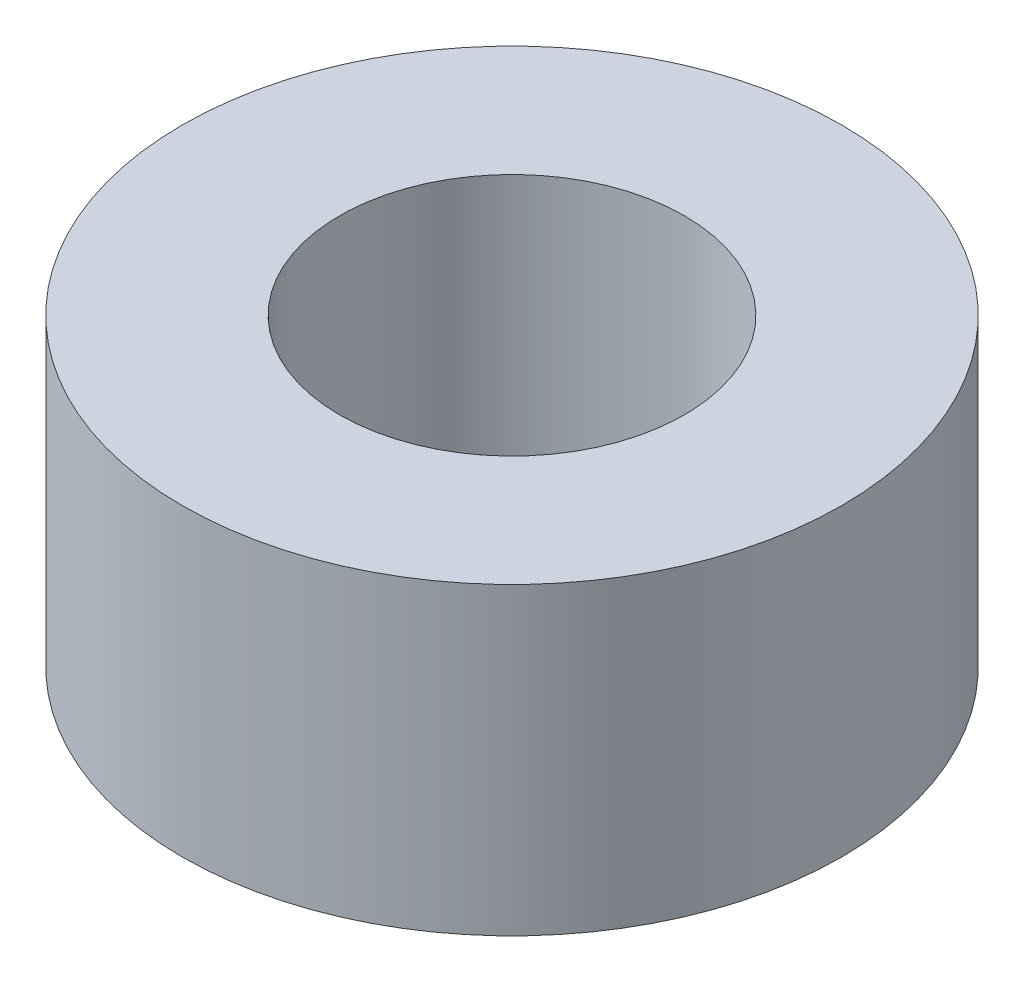
from build123d import *

# Parameters (mm, degrees)
SKETCH1_R           = 3.25
SKETCH1_R_2         = 1.7
BOSS_EXTRUDE1_DEPTH = 3


with BuildPart() as part:
    # Sketch1 → Boss-Extrude1 (new body)
    with BuildSketch(Plane(origin=(0, 0, 0), x_dir=(1, 0, 0), z_dir=(0, 1, 0))):
        with Locations(Location((0, 0, 0), (0, 0, 270))):
            Circle(SKETCH1_R)
        with Locations(Location((0, 0, 0), (0, 0, 270))):
            Circle(SKETCH1_R_2, mode=Mode.SUBTRACT)
    extrude(amount=BOSS_EXTRUDE1_DEPTH)


solid = part.part
